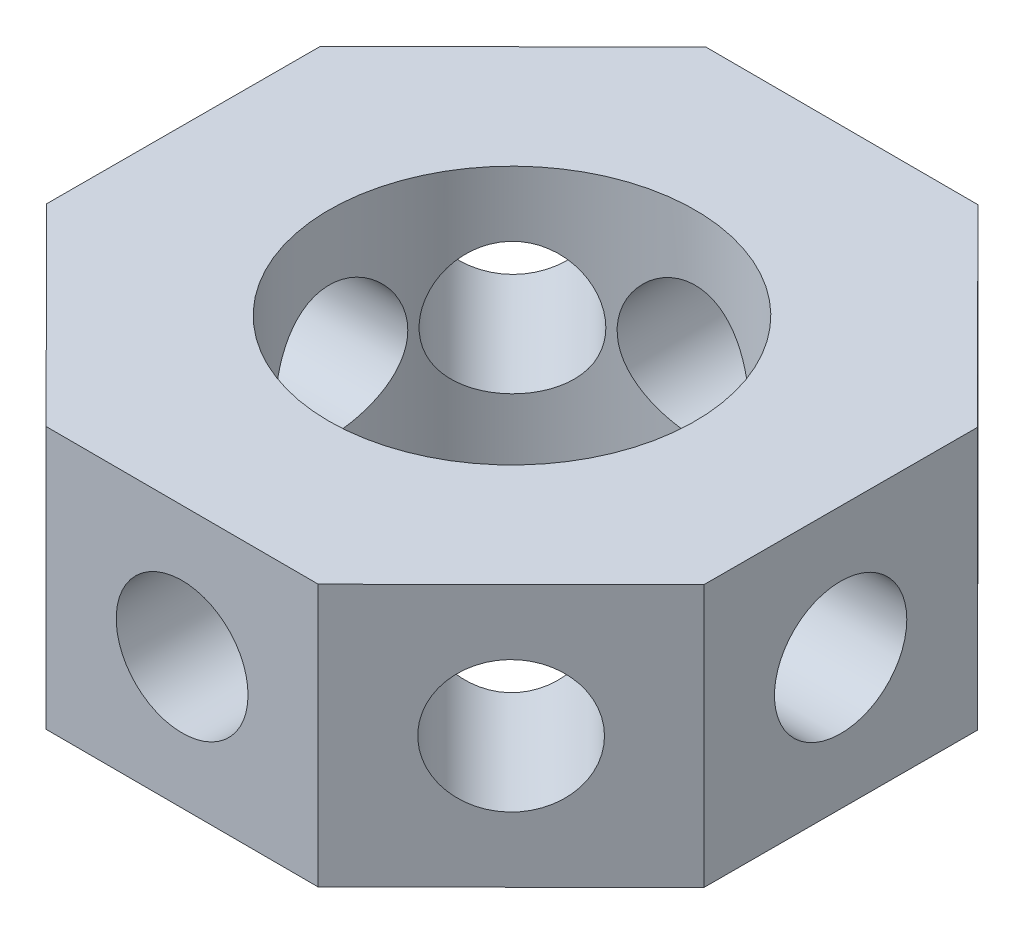
from build123d import *

# Parameters (mm, degrees)
BOSS_EXTRUDE1_DEPTH      = 35.306
BOSS_EXTRUDE1_DEPTH_BACK = 35.306
SKETCH2_R                = 17.78
CUT_EXTRUDE1_DEPTH       = 202.503757234
CIRPATTERN1_COUNT        = 4
CIRPATTERN1_ANGLE        = 135
SKETCH3_R                = 49.276
CUT_EXTRUDE2_DEPTH       = 144.968388357


with BuildPart() as part:
    # Sketch1 → Boss-Extrude1 (new, two sides: drawn at the far end of the back side and taken through both)
    with BuildSketch(Plane(origin=(0, 0, 0), x_dir=(1, 0, 0), z_dir=(0, 1, 0)).offset(-BOSS_EXTRUDE1_DEPTH_BACK)):
        Polygon((88.576287824, -36.886225709), (88.715394104, 36.550393441), (36.886225709, 88.576287824), (-36.550393441, 88.715394104), (-88.576287824, 36.886225709), (-88.715394104, -36.550393441), (-36.886225709, -88.576287824), (36.550393441, -88.715394104), align=None)
    extrude(amount=BOSS_EXTRUDE1_DEPTH + BOSS_EXTRUDE1_DEPTH_BACK)

    # Sketch2 → Cut-Extrude1 (cut, through all)
    with BuildSketch(Plane(origin=(-0.167916134, 0, 88.645840964), x_dir=(0.9999982059400101, 0, 0.0018942324993173733), z_dir=(-0.0018942324993173733, 0, 0.9999982059400101))):
        Circle(SKETCH2_R)
    cut_extrude1 = extrude(amount=-CUT_EXTRUDE1_DEPTH, mode=Mode.SUBTRACT)

    # CirPattern1: Cut-Extrude1 ×4 about axis
    cirpattern1_axis = Axis((0, 35.306, 0), (0, 1, 0))
    for i in range(1, CIRPATTERN1_COUNT):
        add(cut_extrude1.rotate(cirpattern1_axis, i * CIRPATTERN1_ANGLE / (CIRPATTERN1_COUNT - 1)), mode=Mode.SUBTRACT)

    # Sketch3 → Cut-Extrude2 (cut, through all)
    with BuildSketch(Plane(origin=(0, 35.306, 0), x_dir=(1, 0, 0), z_dir=(0, 1, 0))):
        Circle(SKETCH3_R)
    extrude(amount=-CUT_EXTRUDE2_DEPTH, mode=Mode.SUBTRACT)


solid = part.part
